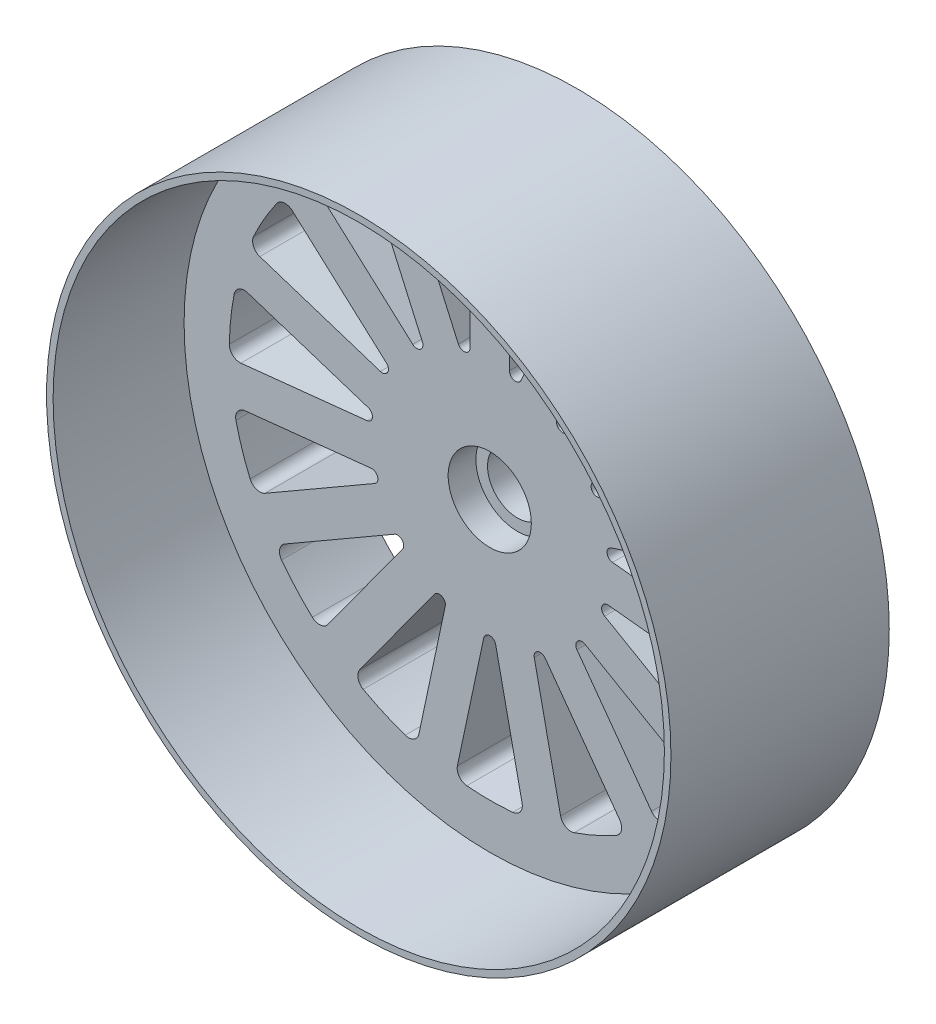
from build123d import *

# Parameters (mm, degrees)
SKETCH1_R               = 35.75
OUTERCASE_DEPTH         = 25
SKETCH2_R               = 35
CUT_EXTRUDE1_DEPTH      = 15
SKETCH3_R               = 4.7625
BEARING_DEPTH           = 3.175
SKETCH4_R               = 3.429
SHAFT_ROOM_DEPTH        = 5
CUT_EXTRUDE4_DEPTH      = 56.616594871
CUT_EXTRUDE4_DEPTH_BACK = 56.616594871
FILLET1_R               = 0.7
FILLET2_R               = 1.2


with BuildPart() as part:
    # Sketch1 → OuterCase (new body)
    with BuildSketch(Plane.XY):
        Circle(SKETCH1_R)
    extrude(amount=OUTERCASE_DEPTH)

    # Sketch2 → Cut-Extrude1 (cut)
    with BuildSketch(Plane.XY.offset(25)):
        Circle(SKETCH2_R)
    extrude(amount=-CUT_EXTRUDE1_DEPTH, mode=Mode.SUBTRACT)

    # Sketch3 → Bearing (cut)
    with BuildSketch(Plane.XY.offset(10)):
        Circle(SKETCH3_R)
    extrude(amount=-BEARING_DEPTH, mode=Mode.SUBTRACT)

    # Sketch4 → Shaft_Room (cut)
    with BuildSketch(Plane.XY.offset(6.825)):
        Circle(SKETCH4_R)
    extrude(amount=-SHAFT_ROOM_DEPTH, mode=Mode.SUBTRACT)

    # Sketch6 → Cut-Extrude4 (cut, two sides: drawn at the far end of the back side and taken through both)
    with BuildSketch(Plane.XY.offset(1.825).offset(-CUT_EXTRUDE4_DEPTH_BACK)):
        with BuildLine():
            ThreePointArc((19.303315658, -22.734538204), (22.163629102, -19.95622128), (24.627741947, -16.821163733))
            Line((24.627741947, -16.821163733), (8.05540901, -7.253122851))
            Line((8.05540901, -7.253122851), (19.303315658, -22.734538204))
        make_face()
        with BuildLine():
            ThreePointArc((26.881426088, -12.917668297), (28.364409143, -9.216155203), (29.340345457, -5.349892635))
            Line((29.340345457, -5.349892635), (10.30909315, -3.349627415))
            Line((10.30909315, -3.349627415), (26.881426088, -12.917668297))
        make_face()
        with BuildLine():
            ThreePointArc((8.387486585, -28.620399919), (12.130556239, -27.245675401), (15.656778118, -25.383902807))
            Line((15.656778118, -25.383902807), (4.40887147, -9.902487453))
            Line((4.40887147, -9.902487453), (8.387486585, -28.620399919))
        make_face()
        with BuildLine():
            ThreePointArc((-3.978615115, -29.55753448), (0, -29.824104727), (3.978615115, -29.55753448))
            Line((3.978615115, -29.55753448), (0, -10.839622014))
            Line((0, -10.839622014), (-3.978615115, -29.55753448))
        make_face()
        with BuildLine():
            ThreePointArc((-15.656778118, -25.383902807), (-12.130556239, -27.245675401), (-8.387486585, -28.620399919))
            Line((-8.387486585, -28.620399919), (-4.40887147, -9.902487453))
            Line((-4.40887147, -9.902487453), (-15.656778118, -25.383902807))
        make_face()
        with BuildLine():
            ThreePointArc((-24.627741947, -16.821163733), (-22.163629102, -19.95622128), (-19.303315658, -22.734538204))
            Line((-19.303315658, -22.734538204), (-8.05540901, -7.253122851))
            Line((-8.05540901, -7.253122851), (-24.627741947, -16.821163733))
        make_face()
        with BuildLine():
            ThreePointArc((-29.340345457, -5.349892635), (-28.364409143, -9.216155203), (-26.881426088, -12.917668297))
            Line((-26.881426088, -12.917668297), (-10.30909315, -3.349627415))
            Line((-10.30909315, -3.349627415), (-29.340345457, -5.349892635))
        make_face()
        with BuildLine():
            ThreePointArc((-28.979736689, 7.046423503), (-29.66072516, 3.117467835), (-29.811493737, -0.867216188))
            Line((-29.811493737, -0.867216188), (-10.78024143, 1.133049031))
            Line((-10.78024143, 1.133049031), (-28.979736689, 7.046423503))
        make_face()
        with BuildLine():
            ThreePointArc((-23.608268175, 18.224349002), (-25.828432338, 14.912052363), (-27.58688329, 11.333185478))
            Line((-27.58688329, 11.333185478), (-9.387388031, 5.419811007))
            Line((-9.387388031, 5.419811007), (-23.608268175, 18.224349002))
        make_face()
        with BuildLine():
            ThreePointArc((-14.154715619, 26.251118995), (-17.530168921, 24.128207566), (-20.592250104, 21.573976416))
            Line((-20.592250104, 21.573976416), (-6.37136996, 8.769438422))
            Line((-6.37136996, 8.769438422), (-14.154715619, 26.251118995))
        make_face()
        with BuildLine():
            Line((-2.253684141, 10.602750266), (-2.253684141, 29.738832031))
            ThreePointArc((-2.253684141, 29.738832031), (-6.200780041, 29.172376482), (-10.037029799, 28.084430839))
            Line((-10.037029799, 28.084430839), (-2.253684141, 10.602750266))
        make_face()
        with BuildLine():
            ThreePointArc((10.037029799, 28.084430839), (6.200780041, 29.172376482), (2.253684141, 29.738832031))
            Line((2.253684141, 29.738832031), (2.253684141, 10.602750266))
            Line((2.253684141, 10.602750266), (10.037029799, 28.084430839))
        make_face()
        with BuildLine():
            ThreePointArc((20.592250104, 21.573976416), (17.530168921, 24.128207566), (14.154715619, 26.251118995))
            Line((14.154715619, 26.251118995), (6.37136996, 8.769438422))
            Line((6.37136996, 8.769438422), (20.592250104, 21.573976416))
        make_face()
        with BuildLine():
            ThreePointArc((27.58688329, 11.333185478), (25.828432338, 14.912052363), (23.608268175, 18.224349002))
            Line((23.608268175, 18.224349002), (9.387388031, 5.419811007))
            Line((9.387388031, 5.419811007), (27.58688329, 11.333185478))
        make_face()
        with BuildLine():
            ThreePointArc((29.811493737, -0.867216188), (29.66072516, 3.117467835), (28.979736689, 7.046423503))
            Line((28.979736689, 7.046423503), (10.78024143, 1.133049031))
            Line((10.78024143, 1.133049031), (29.811493737, -0.867216188))
        make_face()
    extrude(amount=CUT_EXTRUDE4_DEPTH + CUT_EXTRUDE4_DEPTH_BACK, mode=Mode.SUBTRACT)

    # Fillet1
    fillet1_edges = [part.edges().sort_by_distance(p)[0] for p in [
        (-4.40887147, -9.902487453, 5),
        (0, -10.839622014, 5),
        (10.30909315, -3.349627415, 5),
        (4.40887147, -9.902487453, 5),
        (9.387388031, 5.419811007, 5),
        (10.78024143, 1.133049031, 5),
        (2.253684141, 10.602750266, 5),
        (6.37136996, 8.769438422, 5),
        (-6.37136996, 8.769438422, 5),
        (-2.253684141, 10.602750266, 5),
        (8.05540901, -7.253122851, 5),
        (-10.78024143, 1.133049031, 5),
        (-9.387388031, 5.419811007, 5),
        (-8.05540901, -7.253122851, 5),
        (-10.30909315, -3.349627415, 5),
    ]]
    fillet(fillet1_edges, radius=FILLET1_R)

    # Fillet2
    fillet2_edges = [part.edges().sort_by_distance(p)[0] for p in [
        (-26.881426088, -12.917668297, 5),
        (-15.656778118, -25.383902807, 5),
        (-8.387486585, -28.620399919, 5),
        (-3.978615115, -29.55753448, 5),
        (3.978615115, -29.55753448, 5),
        (26.881426088, -12.917668297, 5),
        (29.340345457, -5.349892635, 5),
        (8.387486585, -28.620399919, 5),
        (15.656778118, -25.383902807, 5),
        (27.58688329, 11.333185478, 5),
        (23.608268175, 18.224349002, 5),
        (29.811493737, -0.867216188, 5),
        (28.979736689, 7.046423503, 5),
        (10.037029799, 28.084430839, 5),
        (2.253684141, 29.738832031, 5),
        (20.592250104, 21.573976416, 5),
        (14.154715619, 26.251118995, 5),
        (-14.154715619, 26.251118995, 5),
        (-20.592250104, 21.573976416, 5),
        (-2.253684141, 29.738832031, 5),
        (-10.037029799, 28.084430839, 5),
        (19.303315658, -22.734538204, 5),
        (24.627741947, -16.821163733, 5),
        (-28.979736689, 7.046423503, 5),
        (-29.811493737, -0.867216188, 5),
        (-23.608268175, 18.224349002, 5),
        (-27.58688329, 11.333185478, 5),
        (-24.627741947, -16.821163733, 5),
        (-19.303315658, -22.734538204, 5),
        (-29.340345457, -5.349892635, 5),
    ]]
    fillet(fillet2_edges, radius=FILLET2_R)


solid = part.part
